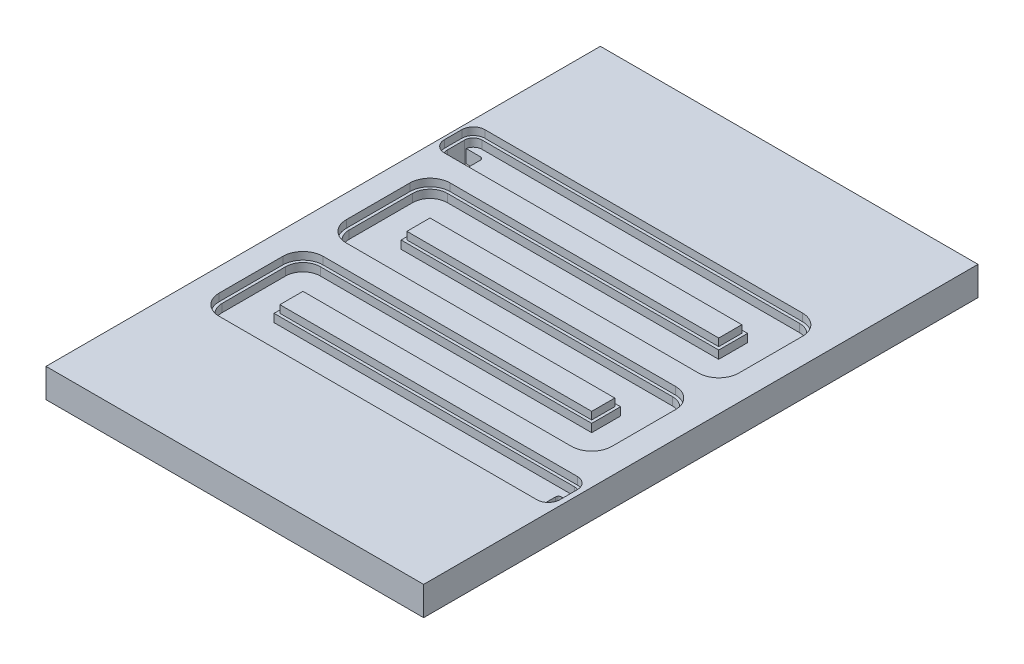
from build123d import *

# Parameters (mm, degrees)
EXTRUDE_1_DEPTH     = 50
CUT_EXTRUDE_1_DEPTH = 13
CUT_EXTRUDE_2_DEPTH = 27
CUT_EXTRUDE_3_DEPTH = 50


with BuildPart() as part:
    # 草图1 → 凸台-拉伸1 (new body)
    with BuildSketch(Plane(origin=(0, 0, 0), x_dir=(1, 0, 0), z_dir=(0, 1, 0))):
        Polygon((0, 0), (654, 0), (654.0000000000001, -960), (1.1757e-13, -960), align=None)
    extrude(amount=-EXTRUDE_1_DEPTH)

    # 草图1<4> → 切除-拉伸1 (cut)
    with BuildSketch(Plane(origin=(0, 0, 0), x_dir=(1, 0, 0), z_dir=(0, 1, 0))):
        with BuildLine():
            Line((5.0000000000000355, -275), (5.0000000000000355, -244.9999999999999))
            ThreePointArc((5.0000000000000355, -244.9999999999999), (10.857864376269086, -230.85786437626894), (25.000000000000036, -224.99999999999986))
            Line((25.000000000000036, -224.99999999999986), (574.9999999999997, -224.99999999999986))
            ThreePointArc((574.9999999999997, -224.99999999999986), (599.748737341529, -235.2512626584707), (609.9999999999999, -260.0000000000001))
            Line((609.9999999999999, -260.0000000000001), (609.9999999999999, -369.9999999999998))
            ThreePointArc((609.9999999999999, -369.9999999999998), (599.748737341529, -394.7487373415292), (574.9999999999997, -405))
            Line((574.9999999999997, -405), (110.0000000000001, -405.00000000000006))
            Line((110.0000000000001, -405.00000000000006), (110.00000000000007, -444.9999999999999))
            Line((110.00000000000007, -444.9999999999999), (574.9999999999998, -444.99999999999966))
            ThreePointArc((574.9999999999998, -444.99999999999966), (599.7487373415292, -455.2512626584705), (610, -479.99999999999994))
            Line((610, -479.99999999999994), (610, -589.9999999999995))
            ThreePointArc((610, -589.9999999999995), (599.7487373415291, -614.7487373415289), (574.9999999999998, -624.9999999999998))
            Line((574.9999999999998, -624.9999999999998), (110.0000000000001, -625))
            Line((110.0000000000001, -625), (110.00000000000011, -665.0000000000001))
            Line((110.00000000000011, -665.0000000000001), (625.0000000000001, -665.0000000000002))
            ThreePointArc((625.0000000000001, -665.0000000000002), (639.142135623731, -670.8578643762693), (645.0000000000001, -685.0000000000001))
            Line((645.0000000000001, -685.0000000000001), (645.0000000000001, -714.9999999999998))
            ThreePointArc((645.0000000000001, -714.9999999999998), (639.1421356237311, -729.1421356237307), (625.0000000000001, -734.9999999999997))
            Line((625.0000000000001, -734.9999999999997), (75.0000000000004, -734.9999999999999))
            ThreePointArc((75.0000000000004, -734.9999999999999), (50.25126265847098, -724.748737341529), (40.000000000000135, -699.9999999999997))
            Line((40.000000000000135, -699.9999999999997), (40.0000000000001, -590.0000000000001))
            ThreePointArc((40.0000000000001, -590.0000000000001), (50.25126265847094, -565.2512626584708), (75.00000000000034, -554.9999999999998))
            Line((75.00000000000034, -554.9999999999998), (539.9999999999999, -554.9999999999998))
            Line((539.9999999999999, -554.9999999999998), (539.9999999999999, -514.9999999999997))
            Line((539.9999999999999, -514.9999999999997), (75.00000000000036, -515))
            ThreePointArc((75.00000000000036, -515), (50.251262658470964, -504.7487373415292), (40.000000000000085, -479.9999999999998))
            Line((40.000000000000085, -479.9999999999998), (40.00000000000005, -370.0000000000004))
            ThreePointArc((40.00000000000005, -370.0000000000004), (50.25126265847087, -345.251262658471), (75.00000000000028, -335.0000000000001))
            Line((75.00000000000028, -335.0000000000001), (540, -335))
            Line((540, -335), (540, -295.00000000000006))
            Line((540, -295.00000000000006), (25.000000000000036, -295.00000000000006))
            ThreePointArc((25.000000000000036, -295.00000000000006), (10.857864376269081, -289.14213562373095), (5.0000000000000355, -275))
        make_face()
    extrude(amount=-CUT_EXTRUDE_1_DEPTH, mode=Mode.SUBTRACT)

    # 草图1<5> → 切除-拉伸2 (cut)
    with BuildSketch(Plane(origin=(0, 0, 0), x_dir=(1, 0, 0), z_dir=(0, 1, 0))):
        with BuildLine():
            Line((25.00000000000002, -229.99999999999986), (574.9999999999999, -229.99999999999983))
            ThreePointArc((574.9999999999999, -229.99999999999983), (596.2132034355964, -238.78679656440343), (604.9999999999999, -259.9999999999999))
            Line((604.9999999999999, -259.9999999999999), (604.9999999999999, -370))
            ThreePointArc((604.9999999999999, -370), (596.2132034355964, -391.2132034355964), (574.9999999999999, -400))
            Line((574.9999999999999, -400), (105.00000000000007, -400.00000000000006))
            Line((105.00000000000007, -400.00000000000006), (105.00000000000007, -449.9999999999999))
            Line((105.00000000000007, -449.9999999999999), (575, -449.99999999999966))
            ThreePointArc((575, -449.99999999999966), (596.2132034355964, -458.78679656440323), (605, -479.99999999999966))
            Line((605, -479.99999999999966), (605, -589.9999999999998))
            ThreePointArc((605, -589.9999999999998), (596.2132034355964, -611.2132034355961), (575, -619.9999999999998))
            Line((575, -619.9999999999998), (105.00000000000011, -620))
            Line((105.00000000000011, -620), (105.00000000000011, -670.0000000000001))
            Line((105.00000000000011, -670.0000000000001), (625, -670.0000000000001))
            ThreePointArc((625, -670.0000000000001), (635.6066017177983, -674.3933982822019), (640.0000000000001, -685.0000000000002))
            Line((640.0000000000001, -685.0000000000002), (640.0000000000001, -714.9999999999997))
            ThreePointArc((640.0000000000001, -714.9999999999997), (635.6066017177983, -725.606601717798), (625, -729.9999999999998))
            Line((625, -729.9999999999998), (75.00000000000007, -730))
            ThreePointArc((75.00000000000007, -730), (53.786796564403645, -721.2132034355964), (45.00000000000012, -700))
            Line((45.00000000000012, -700), (45.00000000000009, -589.9999999999999))
            ThreePointArc((45.00000000000009, -589.9999999999999), (53.78679656440367, -568.7867965644034), (75.00000000000009, -559.9999999999999))
            Line((75.00000000000009, -559.9999999999999), (544.9999999999999, -559.9999999999998))
            Line((544.9999999999999, -559.9999999999998), (544.9999999999999, -509.99999999999966))
            Line((544.9999999999999, -509.99999999999966), (75.00000000000009, -510))
            ThreePointArc((75.00000000000009, -510), (53.786796564403616, -501.2132034355964), (45.00000000000007, -479.99999999999994))
            Line((45.00000000000007, -479.99999999999994), (45.00000000000004, -370.0000000000001))
            ThreePointArc((45.00000000000004, -370.0000000000001), (53.786796564403616, -348.7867965644037), (75.00000000000003, -340.00000000000006))
            Line((75.00000000000003, -340.00000000000006), (545, -340))
            Line((545, -340), (545, -290.00000000000006))
            Line((545, -290.00000000000006), (25.00000000000002, -290.00000000000006))
            ThreePointArc((25.00000000000002, -290.00000000000006), (14.393398282201769, -285.60660171779824), (10.000000000000036, -275))
            Line((10.000000000000036, -275), (10.000000000000036, -244.9999999999999))
            ThreePointArc((10.000000000000036, -244.9999999999999), (14.393398282201789, -234.39339828220164), (25.00000000000002, -229.99999999999986))
        make_face()
    extrude(amount=-CUT_EXTRUDE_2_DEPTH, mode=Mode.SUBTRACT)

    # 草图1<6> → 切除-拉伸3 (cut)
    with BuildSketch(Plane(origin=(0, 0, 0), x_dir=(1, 0, 0), z_dir=(0, 1, 0))):
        with BuildLine():
            ThreePointArc((10.000000000000018, -275), (10.052542158175607, -276.2543939041952), (10.20980054225095, -277.4999999999999))
            Line((10.20980054225095, -277.49999999999994), (35.00000000000021, -277.49999999999994))
            ThreePointArc((35.00000000000021, -277.49999999999994), (38.53553390593298, -276.03553390593265), (40.000000000000256, -272.4999999999999))
            Line((40.00000000000024, -272.4999999999999), (40.00000000000024, -247.5))
            ThreePointArc((40.00000000000024, -247.5), (38.53553390593298, -243.96446609406723), (35.00000000000021, -242.49999999999997))
            Line((35.00000000000021, -242.49999999999997), (10.209800542250957, -242.49999999999997))
            ThreePointArc((10.209800542250964, -242.5), (10.052542158175624, -243.7456060958047), (10.000000000000037, -244.9999999999999))
            Line((10.000000000000036, -244.9999999999999), (10.000000000000036, -275))
        make_face()
        with BuildLine():
            ThreePointArc((640.0000000000002, -717.5), (643.535533905933, -716.0355339059328), (645.0000000000002, -712.5))
            Line((645.0000000000001, -712.5), (645.0000000000001, -687.5))
            ThreePointArc((645.0000000000002, -687.5), (643.535533905933, -683.9644660940672), (640.0000000000002, -682.5))
            Line((640.0000000000002, -682.5), (615.0000000000002, -682.5))
            ThreePointArc((615.0000000000002, -682.5), (611.4644660940675, -683.9644660940672), (610.0000000000002, -687.5))
            Line((610.0000000000002, -687.5), (610.0000000000002, -712.5))
            ThreePointArc((610.0000000000002, -712.5), (611.4644660940675, -716.0355339059328), (615.0000000000002, -717.5))
            Line((615.0000000000002, -717.5), (640.0000000000002, -717.5))
        make_face()
    extrude(amount=-CUT_EXTRUDE_3_DEPTH, mode=Mode.SUBTRACT)


solid = part.part
